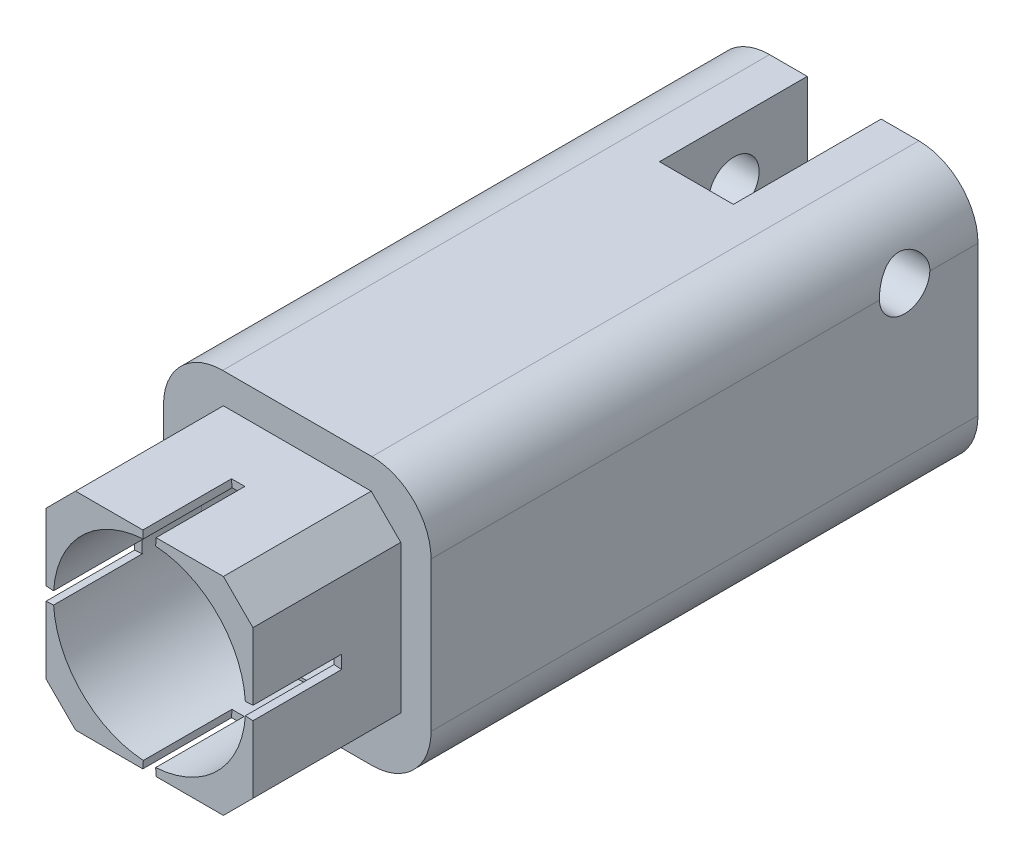
from build123d import *

# Parameters (mm, degrees)
BOSS_EXTRUDE1_DEPTH = 37
SKETCH3_R           = 6.5
BOSS_EXTRUDE2_DEPTH = 10
CUT_EXTRUDE7_DEPTH  = 6
CIRPATTERN1_COUNT   = 4
SKETCH12_R          = 6.5
CUT_EXTRUDE8_DEPTH  = 25
CUT_EXTRUDE9_DEPTH  = 10
SKETCH14_R          = 1.705
CUT_EXTRUDE10_DEPTH = 12.5


with BuildPart() as part:
    # Sketch1 → Boss-Extrude1 (new body)
    with BuildSketch(Plane.XY):
        with BuildLine():
            Line((-5.05, 9.05), (5.05, 9.05))
            ThreePointArc((5.05, 9.05), (7.878427125, 7.878427125), (9.05, 5.05))
            Line((9.05, 5.05), (9.05, -5.05))
            ThreePointArc((9.05, -5.05), (7.878427125, -7.878427125), (5.05, -9.05))
            Line((5.05, -9.05), (-5.05, -9.05))
            ThreePointArc((-5.05, -9.05), (-7.878427125, -7.878427125), (-9.05, -5.05))
            Line((-9.05, -5.05), (-9.05, 5.05))
            ThreePointArc((-9.05, 5.05), (-7.878427125, 7.878427125), (-5.05, 9.05))
        make_face()
    extrude(amount=BOSS_EXTRUDE1_DEPTH)

    # Sketch3 → Boss-Extrude2 (add)
    with BuildSketch(Plane.XY.offset(37)):
        Polygon((-5, -7), (5, -7), (7, -5), (7, 5), (5, 7), (-5, 7), (-7, 5), (-7, -5), align=None)
        Circle(SKETCH3_R, mode=Mode.SUBTRACT)
    extrude(amount=BOSS_EXTRUDE2_DEPTH)

    # Sketch11 → Cut-Extrude7 (cut)
    with BuildSketch(Plane.XY.offset(47)):
        Polygon((0, 0), (7, 0.45), (7, -0.45), align=None)
    cut_extrude7 = extrude(amount=-CUT_EXTRUDE7_DEPTH, mode=Mode.SUBTRACT)

    # CirPattern1: Cut-Extrude7 ×4 about axis
    cirpattern1_axis = Axis((0, 0, 47), (0, 0, -1))
    for i in range(1, CIRPATTERN1_COUNT):
        add(cut_extrude7.rotate(cirpattern1_axis, i * 360 / CIRPATTERN1_COUNT), mode=Mode.SUBTRACT)

    # Sketch12 → Cut-Extrude8 (cut)
    with BuildSketch(Plane.XY.offset(37)):
        with Locations((0, 0.192488852)):
            Circle(SKETCH12_R)
    extrude(amount=-CUT_EXTRUDE8_DEPTH, mode=Mode.SUBTRACT)

    # Sketch13 → Cut-Extrude9 (cut)
    with BuildSketch(Plane.XY):
        with BuildLine():
            Line((-2.5, 0), (-2.5, 9.05))
            Line((-2.5, 9.05), (2.5, 9.05))
            Line((2.5, 9.05), (2.5, 0))
            ThreePointArc((2.5, 0), (0, -2.5), (-2.5, 0))
        make_face()
    extrude(amount=CUT_EXTRUDE9_DEPTH, mode=Mode.SUBTRACT)

    # Sketch14 → Cut-Extrude10 (cut, symmetric)
    with BuildSketch(Plane(origin=(0, 0, 0), x_dir=(0, 0, -1), z_dir=(1, 0, 0))):
        with Locations((-4.963568093, 5.105)):
            Circle(SKETCH14_R)
    extrude(amount=CUT_EXTRUDE10_DEPTH, both=True, mode=Mode.SUBTRACT)


solid = part.part
